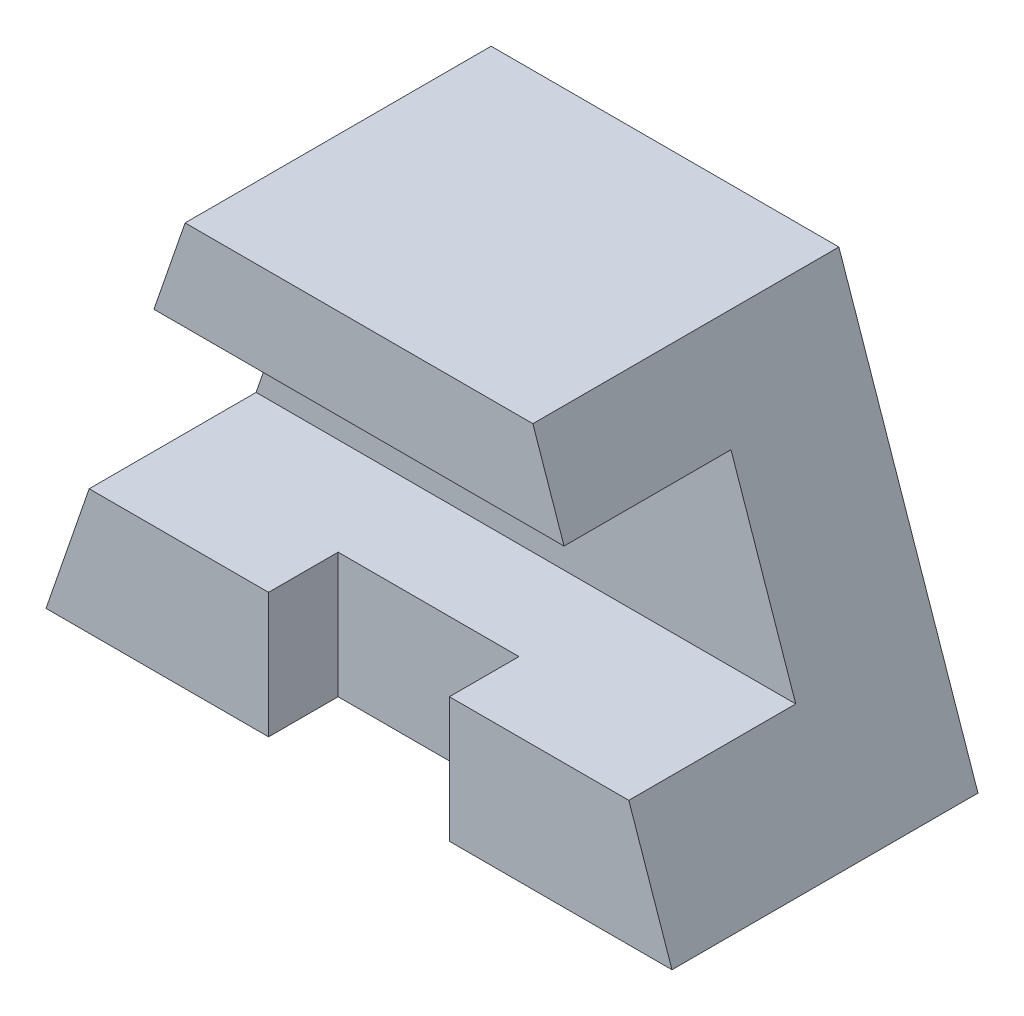
from build123d import *

# Parameters (mm, degrees)
BOSS_EXTRUDE1_DEPTH     = 44
CUT_EXTRUDE1_DEPTH      = 86.586213843
CUT_EXTRUDE1_DEPTH_BACK = 86.586213843
SKETCH2_W               = 24
SKETCH2_H               = 27
SKETCH3_W               = 26
SKETCH3_H               = 18
CUT_EXTRUDE2_DEPTH      = 10


with BuildPart() as part:
    # Sketch1 → Boss-Extrude1 (new body)
    with BuildSketch(Plane.XY):
        Polygon((-45, 0), (45, 0), (25, 58), (-25, 58), align=None)
    extrude(amount=BOSS_EXTRUDE1_DEPTH)

    # Sketch2 → Cut-Extrude1 (cut, two sides: drawn at the far end of the back side and taken through both)
    with BuildSketch(Plane(origin=(0, 0, 0), x_dir=(0, 0, -1), z_dir=(1, 0, 0)).offset(-CUT_EXTRUDE1_DEPTH_BACK)):
        with Locations((-32, 31.5)):
            Rectangle(SKETCH2_W, SKETCH2_H)
    extrude(amount=CUT_EXTRUDE1_DEPTH + CUT_EXTRUDE1_DEPTH_BACK, mode=Mode.SUBTRACT)

    # Sketch3 → Cut-Extrude2 (cut)
    with BuildSketch(Plane.XY.offset(44)):
        with Locations((0, 9)):
            Rectangle(SKETCH3_W, SKETCH3_H)
    extrude(amount=-CUT_EXTRUDE2_DEPTH, mode=Mode.SUBTRACT)


solid = part.part
